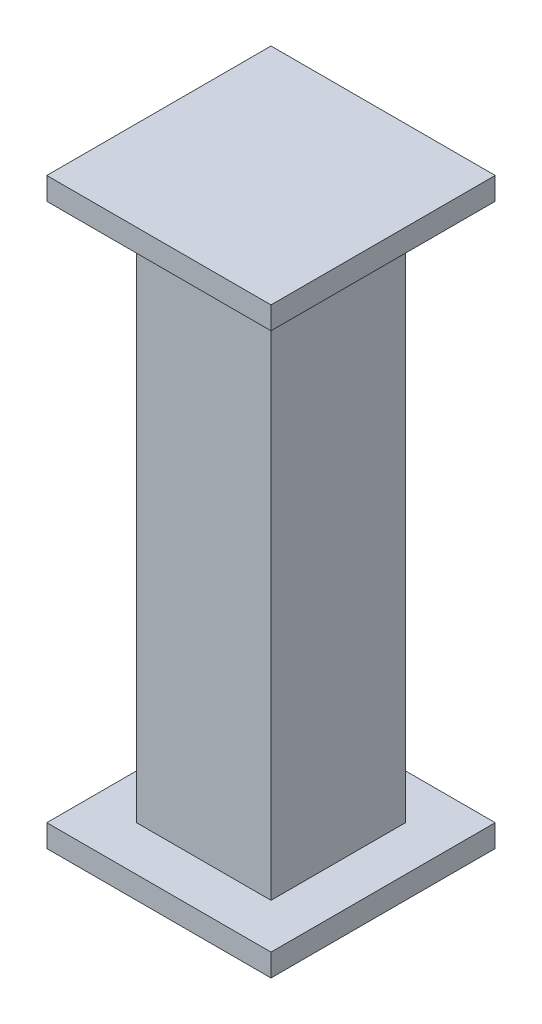
from build123d import *

# Parameters (mm, degrees)
SKETCH1_W           = 12
SKETCH1_H           = 12
SKETCH1_W_2         = 9
SKETCH1_H_2         = 9
BOSS_EXTRUDE1_DEPTH = 48
SKETCH3_W           = 20
SKETCH3_H           = 20
BOSS_EXTRUDE2_DEPTH = 2
SKETCH4_W           = 20
SKETCH4_H           = 20
BOSS_EXTRUDE3_DEPTH = 2


with BuildPart() as part:
    # Sketch1 → Boss-Extrude1 (new body)
    with BuildSketch(Plane(origin=(0, 0, 0), x_dir=(1, 0, 0), z_dir=(0, 1, 0))):
        Rectangle(SKETCH1_W, SKETCH1_H)
        Rectangle(SKETCH1_W_2, SKETCH1_H_2, mode=Mode.SUBTRACT)
    extrude(amount=BOSS_EXTRUDE1_DEPTH)

    # Sketch3 → Boss-Extrude2 (add)
    with BuildSketch(Plane(origin=(0, 0, 0), x_dir=(1, 0, 0), z_dir=(0, 1, 0))):
        Rectangle(SKETCH3_W, SKETCH3_H)
    extrude(amount=-BOSS_EXTRUDE2_DEPTH)

    # Sketch4 → Boss-Extrude3 (add)
    with BuildSketch(Plane(origin=(0, 48, 0), x_dir=(1, 0, 0), z_dir=(0, 1, 0))):
        Rectangle(SKETCH4_W, SKETCH4_H)
    extrude(amount=BOSS_EXTRUDE3_DEPTH)


solid = part.part
